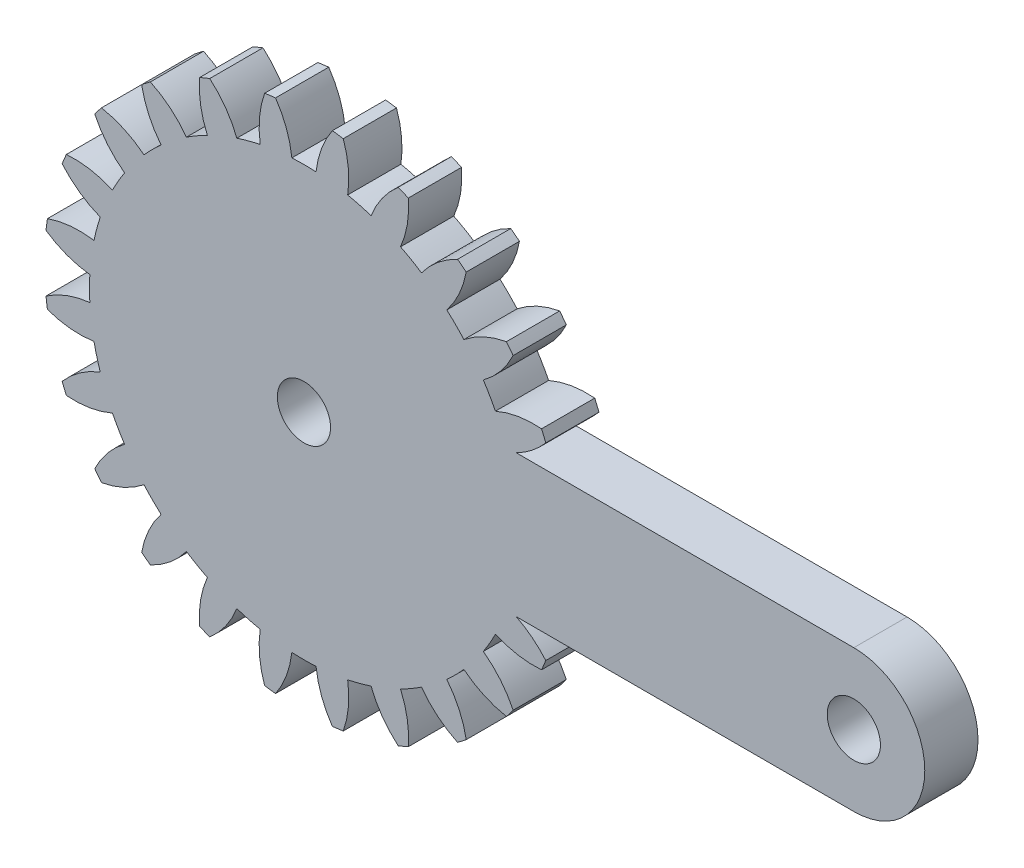
from build123d import *

# Parameters (mm, degrees)
SKETCH1_R           = 1.5
BOSS_EXTRUDE1_DEPTH = 3
SCALE1_SCALE        = 1.9


with BuildPart() as part:
    # Sketch1 → Boss-Extrude1 (new body)
    with BuildSketch(Plane.XY):
        with BuildLine():
            ThreePointArc((31, -4), (35, 0), (31, 4))
            Line((31, 4), (11.967993881, 4))
            ThreePointArc((11.967993881, 4), (12.864888434, 4.573115684), (13.63194632, 5.311020574))
            ThreePointArc((13.63194632, 5.311020574), (13.516357561, 5.598658616), (13.394700346, 5.883783021))
            ThreePointArc((13.394700346, 5.883783021), (12.067442445, 5.825370588), (10.794615193, 5.444665539))
            ThreePointArc((10.794615193, 5.444665539), (10.470247132, 6.045), (10.112526268, 6.626078212))
            ThreePointArc((10.112526268, 6.626078212), (11.078640138, 7.538026423), (11.79285574, 8.658259265))
            ThreePointArc((11.79285574, 8.658259265), (11.606759368, 8.906179706), (11.415451897, 9.150101529))
            ThreePointArc((11.415451897, 9.150101529), (10.148537462, 8.750159829), (9.017614465, 8.052995056))
            ThreePointArc((9.017614465, 8.052995056), (8.548920985, 8.548920985), (8.052995056, 9.017614465))
            ThreePointArc((8.052995056, 9.017614465), (8.750159829, 10.148537462), (9.150101529, 11.415451897))
            ThreePointArc((9.150101529, 11.415451897), (8.906179706, 11.606759368), (8.658259265, 11.79285574))
            ThreePointArc((8.658259265, 11.79285574), (7.538026423, 11.078640138), (6.626078212, 10.112526268))
            ThreePointArc((6.626078212, 10.112526268), (6.045, 10.470247132), (5.444665539, 10.794615193))
            ThreePointArc((5.444665539, 10.794615193), (5.825370588, 12.067442445), (5.883783021, 13.394700346))
            ThreePointArc((5.883783021, 13.394700346), (5.598658616, 13.516357561), (5.311020574, 13.63194632))
            ThreePointArc((5.311020574, 13.63194632), (4.413811339, 12.65212943), (3.78298568, 11.482905527))
            ThreePointArc((3.78298568, 11.482905527), (3.129122255, 11.67804324), (2.465291063, 11.835980736))
            ThreePointArc((2.465291063, 11.835980736), (2.503591968, 13.163971168), (2.216494423, 14.461122103))
            ThreePointArc((2.216494423, 14.461122103), (1.909598192, 14.504838322), (1.601844607, 14.542042286))
            ThreePointArc((1.601844607, 14.542042286), (0.988802307, 13.36339701), (0.682088925, 12.070743751))
            ThreePointArc((0.682088925, 12.070743751), (0, 12.09), (-0.682088925, 12.070743751))
            ThreePointArc((-0.682088925, 12.070743751), (-0.988802307, 13.36339701), (-1.601844607, 14.542042286))
            ThreePointArc((-1.601844607, 14.542042286), (-1.909598192, 14.504838322), (-2.216494423, 14.461122103))
            ThreePointArc((-2.216494423, 14.461122103), (-2.503591968, 13.163971168), (-2.465291063, 11.835980736))
            ThreePointArc((-2.465291063, 11.835980736), (-3.129122255, 11.67804324), (-3.78298568, 11.482905527))
            ThreePointArc((-3.78298568, 11.482905527), (-4.413811339, 12.65212943), (-5.311020574, 13.63194632))
            ThreePointArc((-5.311020574, 13.63194632), (-5.598658616, 13.516357561), (-5.883783021, 13.394700346))
            ThreePointArc((-5.883783021, 13.394700346), (-5.825370588, 12.067442445), (-5.444665539, 10.794615193))
            ThreePointArc((-5.444665539, 10.794615193), (-6.045, 10.470247132), (-6.626078212, 10.112526268))
            ThreePointArc((-6.626078212, 10.112526268), (-7.538026423, 11.078640138), (-8.658259265, 11.79285574))
            ThreePointArc((-8.658259265, 11.79285574), (-8.906179706, 11.606759368), (-9.150101529, 11.415451897))
            ThreePointArc((-9.150101529, 11.415451897), (-8.750159829, 10.148537462), (-8.052995056, 9.017614465))
            ThreePointArc((-8.052995056, 9.017614465), (-8.548920985, 8.548920985), (-9.017614465, 8.052995056))
            ThreePointArc((-9.017614465, 8.052995056), (-10.148537462, 8.750159829), (-11.415451897, 9.150101529))
            ThreePointArc((-11.415451897, 9.150101529), (-11.606759368, 8.906179706), (-11.79285574, 8.658259265))
            ThreePointArc((-11.79285574, 8.658259265), (-11.078640138, 7.538026423), (-10.112526268, 6.626078212))
            ThreePointArc((-10.112526268, 6.626078212), (-10.470247132, 6.045), (-10.794615193, 5.444665539))
            ThreePointArc((-10.794615193, 5.444665539), (-12.067442445, 5.825370588), (-13.394700346, 5.883783021))
            ThreePointArc((-13.394700346, 5.883783021), (-13.516357561, 5.598658616), (-13.63194632, 5.311020574))
            ThreePointArc((-13.63194632, 5.311020574), (-12.65212943, 4.413811339), (-11.482905527, 3.78298568))
            ThreePointArc((-11.482905527, 3.78298568), (-11.67804324, 3.129122255), (-11.835980736, 2.465291063))
            ThreePointArc((-11.835980736, 2.465291063), (-13.163971168, 2.503591968), (-14.461122103, 2.216494423))
            ThreePointArc((-14.461122103, 2.216494423), (-14.504838322, 1.909598192), (-14.542042286, 1.601844607))
            ThreePointArc((-14.542042286, 1.601844607), (-13.36339701, 0.988802307), (-12.070743751, 0.682088925))
            ThreePointArc((-12.070743751, 0.682088925), (-12.09, 0), (-12.070743751, -0.682088925))
            ThreePointArc((-12.070743751, -0.682088925), (-13.36339701, -0.988802307), (-14.542042286, -1.601844607))
            ThreePointArc((-14.542042286, -1.601844607), (-14.504838322, -1.909598192), (-14.461122103, -2.216494423))
            ThreePointArc((-14.461122103, -2.216494423), (-13.163971168, -2.503591968), (-11.835980736, -2.465291063))
            ThreePointArc((-11.835980736, -2.465291063), (-11.67804324, -3.129122255), (-11.482905527, -3.78298568))
            ThreePointArc((-11.482905527, -3.78298568), (-12.65212943, -4.413811339), (-13.63194632, -5.311020574))
            ThreePointArc((-13.63194632, -5.311020574), (-13.516357561, -5.598658616), (-13.394700346, -5.883783021))
            ThreePointArc((-13.394700346, -5.883783021), (-12.067442445, -5.825370588), (-10.794615193, -5.444665539))
            ThreePointArc((-10.794615193, -5.444665539), (-10.470247132, -6.045), (-10.112526268, -6.626078212))
            ThreePointArc((-10.112526268, -6.626078212), (-11.078640138, -7.538026423), (-11.79285574, -8.658259265))
            ThreePointArc((-11.79285574, -8.658259265), (-11.606759368, -8.906179706), (-11.415451897, -9.150101529))
            ThreePointArc((-11.415451897, -9.150101529), (-10.148537462, -8.750159829), (-9.017614465, -8.052995056))
            ThreePointArc((-9.017614465, -8.052995056), (-8.548920985, -8.548920985), (-8.052995056, -9.017614465))
            ThreePointArc((-8.052995056, -9.017614465), (-8.750159829, -10.148537462), (-9.150101529, -11.415451897))
            ThreePointArc((-9.150101529, -11.415451897), (-8.906179706, -11.606759368), (-8.658259265, -11.79285574))
            ThreePointArc((-8.658259265, -11.79285574), (-7.538026423, -11.078640138), (-6.626078212, -10.112526268))
            ThreePointArc((-6.626078212, -10.112526268), (-6.045, -10.470247132), (-5.444665539, -10.794615193))
            ThreePointArc((-5.444665539, -10.794615193), (-5.825370588, -12.067442445), (-5.883783021, -13.394700346))
            ThreePointArc((-5.883783021, -13.394700346), (-5.598658616, -13.516357561), (-5.311020574, -13.63194632))
            ThreePointArc((-5.311020574, -13.63194632), (-4.413811339, -12.65212943), (-3.78298568, -11.482905527))
            ThreePointArc((-3.78298568, -11.482905527), (-3.129122255, -11.67804324), (-2.465291063, -11.835980736))
            ThreePointArc((-2.465291063, -11.835980736), (-2.503591968, -13.163971168), (-2.216494423, -14.461122103))
            ThreePointArc((-2.216494423, -14.461122103), (-1.909598192, -14.504838322), (-1.601844607, -14.542042286))
            ThreePointArc((-1.601844607, -14.542042286), (-0.988802307, -13.36339701), (-0.682088925, -12.070743751))
            ThreePointArc((-0.682088925, -12.070743751), (0, -12.09), (0.682088925, -12.070743751))
            ThreePointArc((0.682088925, -12.070743751), (0.988802307, -13.36339701), (1.601844607, -14.542042286))
            ThreePointArc((1.601844607, -14.542042286), (1.909598192, -14.504838322), (2.216494423, -14.461122103))
            ThreePointArc((2.216494423, -14.461122103), (2.503591968, -13.163971168), (2.465291063, -11.835980736))
            ThreePointArc((2.465291063, -11.835980736), (3.129122255, -11.67804324), (3.78298568, -11.482905527))
            ThreePointArc((3.78298568, -11.482905527), (4.413811339, -12.65212943), (5.311020574, -13.63194632))
            ThreePointArc((5.311020574, -13.63194632), (5.598658616, -13.516357561), (5.883783021, -13.394700346))
            ThreePointArc((5.883783021, -13.394700346), (5.825370588, -12.067442445), (5.444665539, -10.794615193))
            ThreePointArc((5.444665539, -10.794615193), (6.045, -10.470247132), (6.626078212, -10.112526268))
            ThreePointArc((6.626078212, -10.112526268), (7.538026423, -11.078640138), (8.658259265, -11.79285574))
            ThreePointArc((8.658259265, -11.79285574), (8.906179706, -11.606759368), (9.150101529, -11.415451897))
            ThreePointArc((9.150101529, -11.415451897), (8.750159829, -10.148537462), (8.052995056, -9.017614465))
            ThreePointArc((8.052995056, -9.017614465), (8.548920985, -8.548920985), (9.017614465, -8.052995056))
            ThreePointArc((9.017614465, -8.052995056), (10.148537462, -8.750159829), (11.415451897, -9.150101529))
            ThreePointArc((11.415451897, -9.150101529), (11.606759368, -8.906179706), (11.79285574, -8.658259265))
            ThreePointArc((11.79285574, -8.658259265), (11.078640138, -7.538026423), (10.112526268, -6.626078212))
            ThreePointArc((10.112526268, -6.626078212), (10.470247132, -6.045), (10.794615193, -5.444665539))
            ThreePointArc((10.794615193, -5.444665539), (12.067442445, -5.825370588), (13.394700346, -5.883783021))
            ThreePointArc((13.394700346, -5.883783021), (13.516357561, -5.598658616), (13.63194632, -5.311020574))
            ThreePointArc((13.63194632, -5.311020574), (12.864888434, -4.573115684), (11.967993881, -4))
            Line((11.967993881, -4), (31, -4))
        make_face()
        Circle(SKETCH1_R, mode=Mode.SUBTRACT)
        with Locations((31, 0)):
            Circle(SKETCH1_R, mode=Mode.SUBTRACT)
    extrude(amount=-BOSS_EXTRUDE1_DEPTH)


with BuildPart() as part_1:
    # Scale1: scaled about (5.383637445, 0, -1.5)
    add(part.part.scale(SCALE1_SCALE).moved(Location((-4.8452737, 0, 1.35))))


solid = part_1.part
